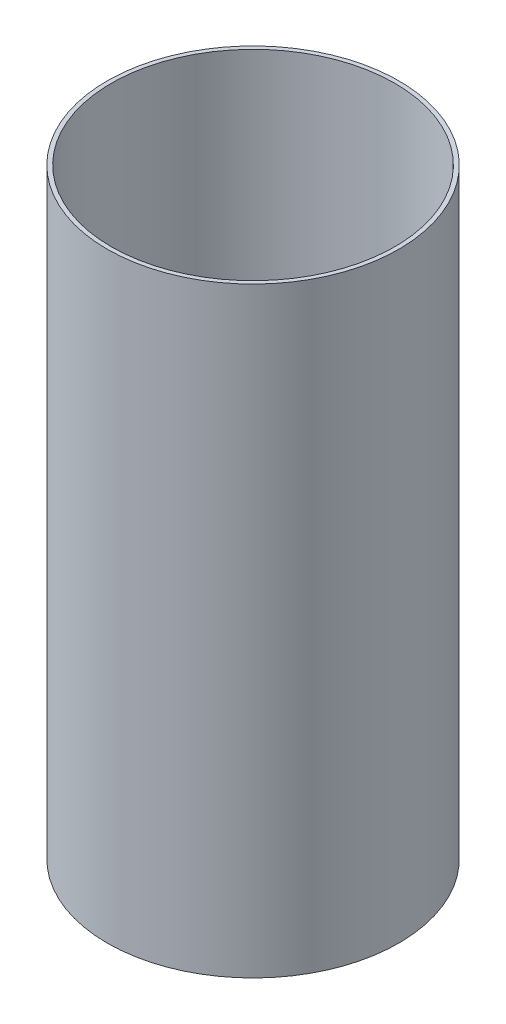
from build123d import *

# Parameters (mm, degrees)
SKETCH1_R           = 76.2
SKETCH1_R_2         = 74.04
BOSS_EXTRUDE1_DEPTH = 314


with BuildPart() as part:
    # Sketch1 → Boss-Extrude1 (new body)
    with BuildSketch(Plane(origin=(0, 0, 0), x_dir=(1, 0, 0), z_dir=(0, 1, 0))):
        with Locations(Location((0, 0, 0), (0, 0, 270))):
            Circle(SKETCH1_R)
        with Locations(Location((0, 0, 0), (0, 0, 270))):
            Circle(SKETCH1_R_2, mode=Mode.SUBTRACT)
    extrude(amount=BOSS_EXTRUDE1_DEPTH)


solid = part.part
